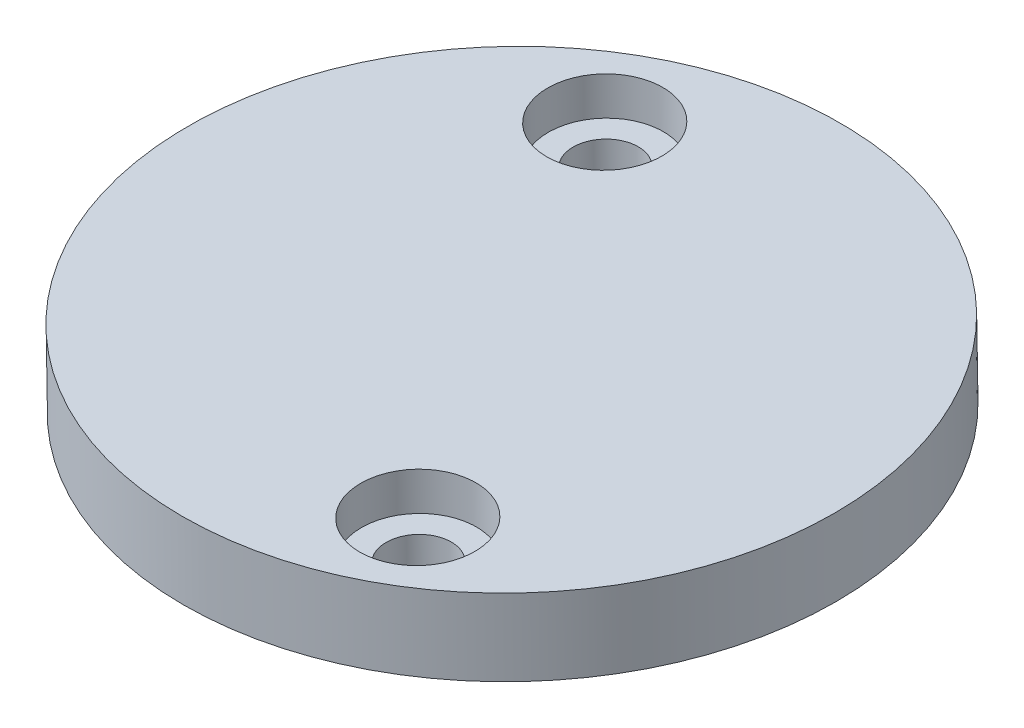
from build123d import *

# Parameters (mm, degrees)
SKETCH1_R           = 17
SKETCH1_R_2         = 2.1
SKETCH1_R_3         = 1.7
BOSS_EXTRUDE1_DEPTH = 4
BOSS_EXTRUDE2_START = -6
SKETCH2_R           = 2.1
BOSS_EXTRUDE2_DEPTH = 6
CUT_EXTRUDE1_START  = -2
SKETCH3_R           = 3
SKETCH3_R_2         = 1.7
CUT_EXTRUDE1_DEPTH  = 2


with BuildPart() as part:
    # Sketch1 → Boss-Extrude1 (new body)
    with BuildSketch(Plane(origin=(0, 292.043042306, 5.097630265), x_dir=(1, 0, 0), z_dir=(0, 0.9998476951563913, 0.017452406437283286))):
        with Locations(Location((109.84658574, -203.196308074, 0), (0, 0, 270))):
            Circle(SKETCH1_R)
        with Locations(Location((120.910918653, -196.961684011, 0), (0, 0, 270))):
            Circle(SKETCH1_R_2, mode=Mode.SUBTRACT)
        with Locations(Location((98.782252828, -209.430932137, 0), (0, 0, 270))):
            Circle(SKETCH1_R_2, mode=Mode.SUBTRACT)
        with Locations(Location((116.081209803, -214.260640986, 0), (0, 0, 270))):
            Circle(SKETCH1_R_3, mode=Mode.SUBTRACT)
        with Locations(Location((103.611961678, -192.131975161, 0), (0, 0, 270))):
            Circle(SKETCH1_R_3, mode=Mode.SUBTRACT)
    extrude(amount=BOSS_EXTRUDE1_DEPTH)

    # Sketch2 → Boss-Extrude2 (add)
    with BuildSketch(Plane(origin=(0, 296.042433086, 5.167439891), x_dir=(1, 0, 0), z_dir=(0, 0.9998476951563913, 0.01745240643728325)).offset(BOSS_EXTRUDE2_START)):
        with Locations(Location((98.782252828, -209.430932137, 0), (0, 0, 270))):
            Circle(SKETCH2_R)
        with Locations(Location((120.910918653, -196.961684011, 0), (0, 0, 270))):
            Circle(SKETCH2_R)
    extrude(amount=BOSS_EXTRUDE2_DEPTH)

    # Sketch3 → Cut-Extrude1 (cut)
    # profile 1 of 2: a face of its own
    with BuildSketch(Plane(origin=(0, 296.042433086, 5.167439891), x_dir=(1, 0, 0), z_dir=(0, 0.9998476951563913, 0.01745240643728325)).offset(CUT_EXTRUDE1_START)):
        with Locations(Location((103.611961678, -192.131975161, 0), (0, 0, 270))):
            Circle(SKETCH3_R)
        with Locations(Location((103.611961678, -192.131975161, 0), (0, 0, 270))):
            Circle(SKETCH3_R_2, mode=Mode.SUBTRACT)
    # profile 2 of 2: a face of its own
    with BuildSketch(Plane(origin=(0, 296.042433086, 5.167439891), x_dir=(1, 0, 0), z_dir=(0, 0.9998476951563913, 0.01745240643728325)).offset(CUT_EXTRUDE1_START)):
        with Locations(Location((116.081209803, -214.260640986, 0), (0, 0, 270))):
            Circle(SKETCH3_R)
        with Locations(Location((116.081209803, -214.260640986, 0), (0, 0, 270))):
            Circle(SKETCH3_R_2, mode=Mode.SUBTRACT)
    extrude(amount=CUT_EXTRUDE1_DEPTH, mode=Mode.SUBTRACT)


solid = part.part
